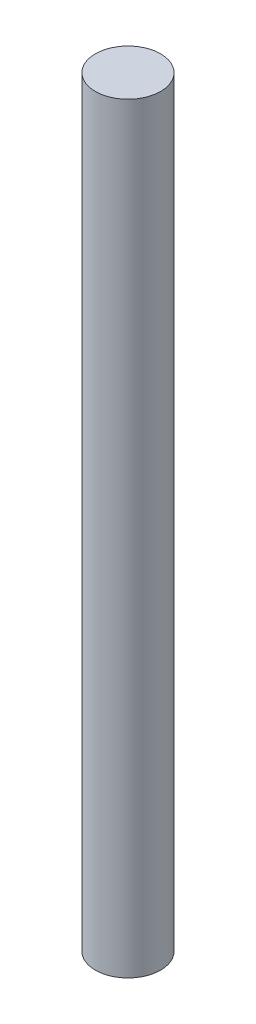
from build123d import *

# Parameters (mm, degrees)
SKETCH1_R           = 3
BOSS_EXTRUDE1_DEPTH = 70


with BuildPart() as part:
    # Sketch1 → Boss-Extrude1 (new body)
    with BuildSketch(Plane(origin=(0, 0, 0), x_dir=(1, 0, 0), z_dir=(0, 1, 0))):
        with Locations(Location((0, 0, 0), (0, 0, 270))):
            Circle(SKETCH1_R)
    extrude(amount=BOSS_EXTRUDE1_DEPTH)


solid = part.part
